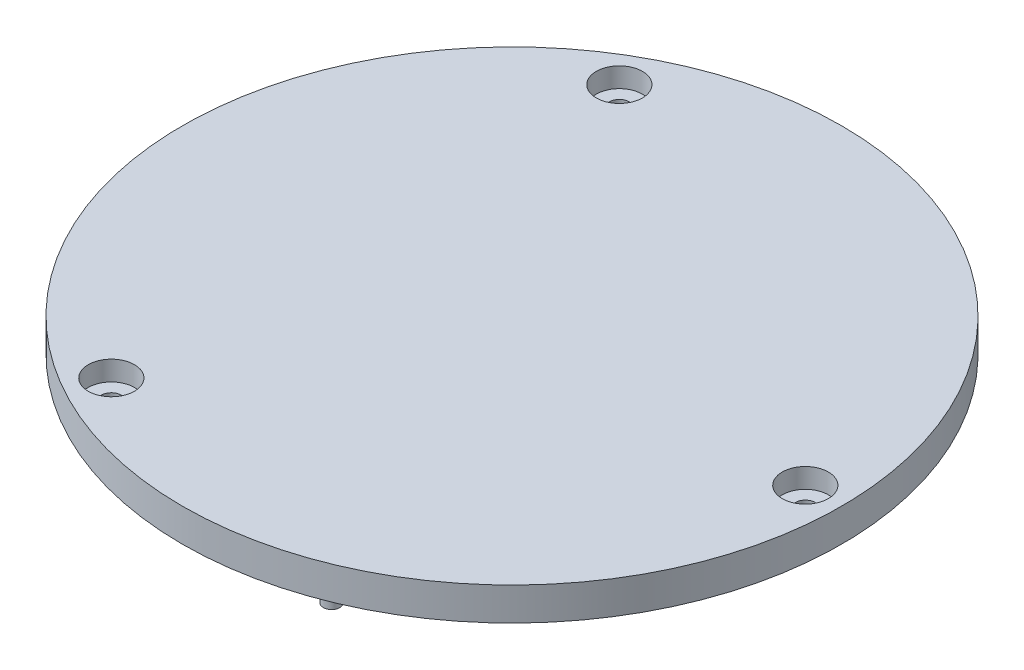
from build123d import *

# Parameters (mm, degrees)
CROQUIS1_R                 = 50
SALIENTE_EXTRUIR1_DEPTH    = 5
CROQUIS2_R                 = 1.5
CORTAR_EXTRUIR1_DEPTH      = 5
CROQUIS3_R                 = 3.5
CORTAR_EXTRUIR2_DEPTH      = 3
MATRIZC2_COUNT             = 3
CROQUIS4_R                 = 3
SALIENTE_EXTRUIR2_DEPTH    = 5
CROQUIS6_R                 = 2.55
SALIENTE_EXTRUIR4_DEPTH    = 2
SALIENTE_EXTRUIR5_DEPTH    = 12
CORTAR_EXTRUIR3_DEPTH      = 99.269119567
CORTAR_EXTRUIR3_DEPTH_BACK = 25
CROQUIS8_W                 = 8
CROQUIS8_H                 = 5
CROQUIS9_W                 = 5
CROQUIS9_H                 = 1.5
CORTAR_EXTRUIR4_DEPTH      = 11
REDONDEO1_R                = 1.5
CROQUIS10_R                = 3
SALIENTE_EXTRUIR6_DEPTH    = 5
CROQUIS5_R                 = 1.25
SALIENTE_EXTRUIR7_DEPTH    = 5
CROQUIS12_R                = 1.05
SALIENTE_EXTRUIR8_DEPTH    = 5
CROQUIS11_R                = 2.5
SALIENTE_EXTRUIR9_DEPTH    = 4
CROQUIS13_R                = 1
SALIENTE_EXTRUIR10_DEPTH   = 5


with BuildPart() as part:
    # Croquis1 → Saliente-Extruir1 (new body)
    with BuildSketch(Plane(origin=(0, 0, 0), x_dir=(1, 0, 0), z_dir=(0, 1, 0))):
        with Locations(Location((0, 0, 0), (0, 0, 270))):
            Circle(CROQUIS1_R)
    extrude(amount=SALIENTE_EXTRUIR1_DEPTH)

    # Croquis2 → Cortar-Extruir1 (cut)
    with BuildSketch(Plane(origin=(0, 5, 0), x_dir=(1, 0, 0), z_dir=(0, 1, 0))):
        with Locations(Location((44.5, 0, 0), (0, 0, 270))):
            Circle(CROQUIS2_R)
    cortar_extruir1 = extrude(amount=-CORTAR_EXTRUIR1_DEPTH, mode=Mode.SUBTRACT)

    # Croquis3 → Cortar-Extruir2 (cut)
    with BuildSketch(Plane(origin=(0, 5, 0), x_dir=(1, 0, 0), z_dir=(0, 1, 0))):
        with Locations(Location((44.5, 0, 0), (0, 0, 270))):
            Circle(CROQUIS3_R)
    cortar_extruir2 = extrude(amount=-CORTAR_EXTRUIR2_DEPTH, mode=Mode.SUBTRACT)

    # MatrizC2: Cortar-Extruir1, Cortar-Extruir2 ×3 about axis
    matrizc2_axis = Axis((0, 0, 0), (0, 1, 0))
    add([cortar_extruir1.rotate(matrizc2_axis, i * 360 / MATRIZC2_COUNT) for i in range(1, MATRIZC2_COUNT)], mode=Mode.SUBTRACT)
    add([cortar_extruir2.rotate(matrizc2_axis, i * 360 / MATRIZC2_COUNT) for i in range(1, MATRIZC2_COUNT)], mode=Mode.SUBTRACT)

    # Croquis4 → Saliente-Extruir2 (add)
    with BuildSketch(Plane.XZ):
        with Locations(Location((-32, 14.7, 0), (0, 0, 90))):
            Circle(CROQUIS4_R)
        with Locations(Location((-32, -14.7, 0), (0, 0, 90))):
            Circle(CROQUIS4_R)
    extrude(amount=SALIENTE_EXTRUIR2_DEPTH)

    # Croquis6 → Saliente-Extruir4 (add)
    with BuildSketch(Plane.XZ):
        with Locations(Location((27.173827718, 5.816127145, 0), (0, 0, 90))):
            Circle(CROQUIS6_R)
        with Locations(Location((37.323827718, -11.764188552, 0), (0, 0, 90))):
            Circle(CROQUIS6_R)
        with Locations(Location((-14.51663522, -18.253872855, 0), (0, 0, 90))):
            Circle(CROQUIS6_R)
        with Locations(Location((-4.36663522, -35.834188552, 0), (0, 0, 90))):
            Circle(CROQUIS6_R)
    extrude(amount=SALIENTE_EXTRUIR4_DEPTH)

    # Croquis7 → Saliente-Extruir5 (add)
    with BuildSketch(Plane.XZ):
        Polygon((2.190063509, 1.20669873), (23.840698604, 13.70669873), (18.340698604, 23.232978171), (-3.309936491, 10.732978171), align=None)
    extrude(amount=SALIENTE_EXTRUIR5_DEPTH)

    # Croquis8 → Cortar-Extruir3 (cut, two sides: drawn at the far end of the back side and taken through both)
    with BuildSketch(Plane(origin=(23.815698604, 0, 13.75), x_dir=(0.49999999999999806, 0, -0.8660254037844398), z_dir=(0.8660254037844397, 0, 0.499999999999998)).offset(-CORTAR_EXTRUIR3_DEPTH_BACK)):
        with Locations((-5.45, -9.5)):
            Rectangle(CROQUIS8_W, CROQUIS8_H)
    extrude(amount=CORTAR_EXTRUIR3_DEPTH + CORTAR_EXTRUIR3_DEPTH_BACK, mode=Mode.SUBTRACT)

    # Croquis9 → Cortar-Extruir4 (cut)
    with BuildSketch(Plane(origin=(-5.475, 0, 9.482978171), x_dir=(0.8660254037844398, 0, 0.49999999999999806), z_dir=(-0.499999999999998, 0, 0.8660254037844397))):
        with Locations((7.5, -4)):
            Rectangle(CROQUIS9_W, CROQUIS9_H)
        with Locations((22.5, -4)):
            Rectangle(CROQUIS9_W, CROQUIS9_H)
    extrude(amount=-CORTAR_EXTRUIR4_DEPTH, mode=Mode.SUBTRACT)

    # Redondeo1
    redondeo1_edges = [part.edges().sort_by_distance(p)[0] for p in [
        (8.265381057, -7, 15.683940066),
        (12.265381057, -7, 8.755736835),
    ]]
    fillet(redondeo1_edges, radius=REDONDEO1_R)

    # Croquis10 → Saliente-Extruir6 (add)
    with BuildSketch(Plane.XZ):
        with Locations(Location((9.016660498, 36.382685902, 0), (0, 0, 90))):
            Circle(CROQUIS10_R)
        with Locations(Location((-25.624355653, 16.382685902, 0), (0, 0, 90))):
            Circle(CROQUIS10_R)
    extrude(amount=SALIENTE_EXTRUIR6_DEPTH)

    # Croquis5 → Saliente-Extruir7 (add)
    with BuildSketch(Plane.XZ.offset(5)):
        with Locations(Location((9.016660498, 36.382685902, 0), (0, 0, 270))):
            Circle(CROQUIS5_R)
        with Locations(Location((-25.624355653, 16.382685902, 0), (0, 0, 270))):
            Circle(CROQUIS5_R)
        with Locations(Location((-32, 14.7, 0), (0, 0, 270))):
            Circle(CROQUIS5_R)
        with Locations(Location((-32, -14.7, 0), (0, 0, 270))):
            Circle(CROQUIS5_R)
    extrude(amount=SALIENTE_EXTRUIR7_DEPTH)

    # Croquis12 → Saliente-Extruir8 (add)
    with BuildSketch(Plane.XZ.offset(2)):
        with Locations(Location((27.173827718, 5.816127145, 0), (0, 0, 270))):
            Circle(CROQUIS12_R)
        with Locations(Location((37.323827718, -11.764188552, 0), (0, 0, 270))):
            Circle(CROQUIS12_R)
        with Locations(Location((-4.36663522, -35.834188552, 0), (0, 0, 270))):
            Circle(CROQUIS12_R)
        with Locations(Location((-14.51663522, -18.253872855, 0), (0, 0, 270))):
            Circle(CROQUIS12_R)
    extrude(amount=SALIENTE_EXTRUIR8_DEPTH)

    # Croquis11 → Saliente-Extruir9 (add)
    with BuildSketch(Plane.XZ):
        with Locations(Location((15.322510954, -35.239367471, 0), (0, 0, 90))):
            Circle(CROQUIS11_R)
        with Locations(Location((22.856931966, -30.889367471, 0), (0, 0, 90))):
            Circle(CROQUIS11_R)
    extrude(amount=SALIENTE_EXTRUIR9_DEPTH)

    # Croquis13 → Saliente-Extruir10 (add)
    with BuildSketch(Plane.XZ.offset(4)):
        with Locations(Location((22.856931966, -30.889367471, 0), (0, 0, 270))):
            Circle(CROQUIS13_R)
        with Locations(Location((15.322510954, -35.239367471, 0), (0, 0, 270))):
            Circle(CROQUIS13_R)
    extrude(amount=SALIENTE_EXTRUIR10_DEPTH)


solid = part.part
